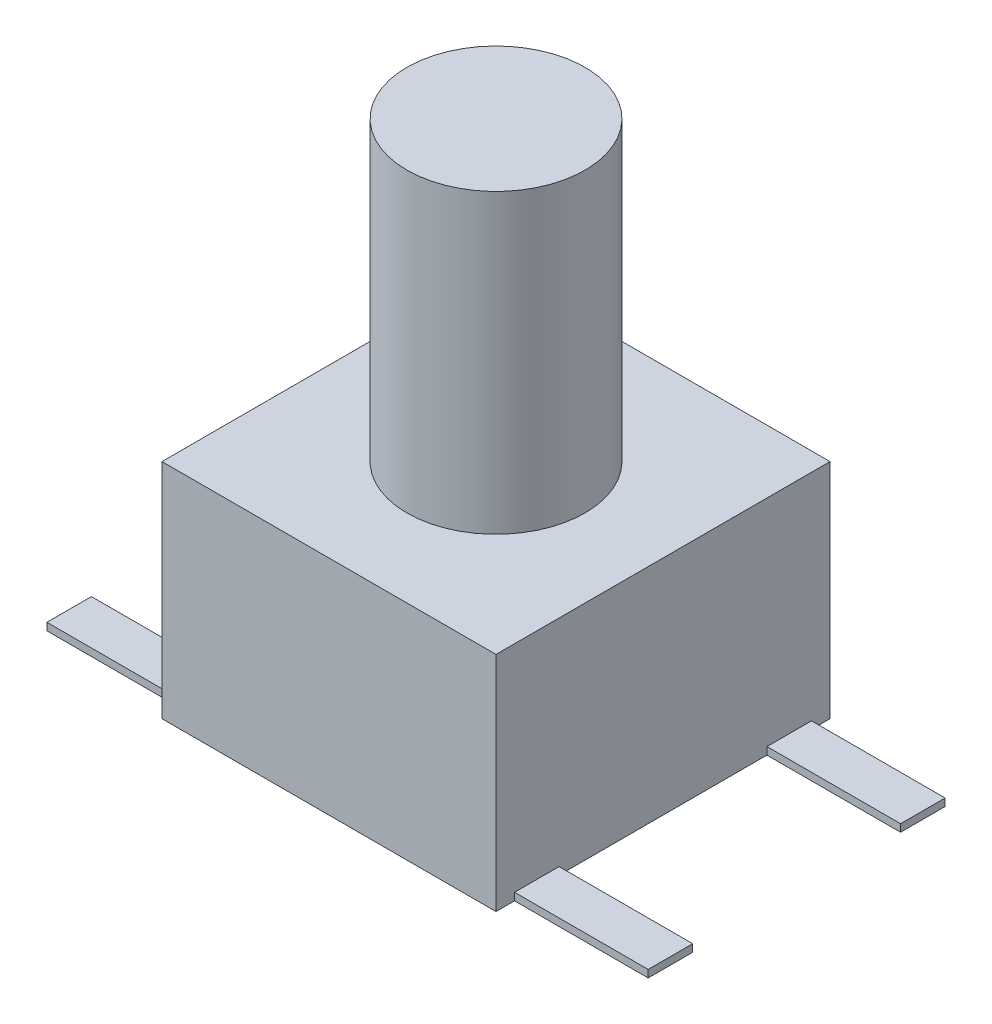
from build123d import *

# Parameters (mm, degrees)
SKETCH_1_W        = 4.5
SKETCH_1_H        = 4.5
EXTRUDE_1_DEPTH   = 3
SKETCH_2_R        = 1.2
EXTRUDE_2_DEPTH   = 7
SKETCH_3_W        = 1.8
SKETCH_3_H        = 0.6
EXTRUDE_3_DEPTH   = 0.1
EXTRUDE_3_2_DEPTH = 0.1
EXTRUDE_3_3_DEPTH = 0.1
EXTRUDE_3_4_DEPTH = 0.1


with BuildPart() as part:
    # Эскиз1 → Бобышка-Вытянуть1 (new body)
    with BuildSketch(Plane(origin=(0, 0, 0), x_dir=(1, 0, 0), z_dir=(0, 1, 0))):
        Rectangle(SKETCH_1_W, SKETCH_1_H)
    extrude(amount=EXTRUDE_1_DEPTH)

    # Эскиз2 → Бобышка-Вытянуть2 (add)
    with BuildSketch(Plane(origin=(0, 0, 0), x_dir=(1, 0, 0), z_dir=(0, 1, 0))):
        with Locations(Location((0, 0, 0), (0, 0, 270))):
            Circle(SKETCH_2_R)
    extrude(amount=EXTRUDE_2_DEPTH)


with BuildPart() as body_2:
    # Эскиз3 → Бобышка-Вытянуть3 (new body)
    with BuildSketch(Plane(origin=(0, 0, 0), x_dir=(1, 0, 0), z_dir=(0, 1, 0))):
        with Locations((-3.15, -1.7)):
            Rectangle(SKETCH_3_W, SKETCH_3_H)
    extrude(amount=EXTRUDE_3_DEPTH)


with BuildPart() as body_3:
    # Эскиз3 → Extrude 3 2 (new body)
    with BuildSketch(Plane(origin=(0, 0, 0), x_dir=(1, 0, 0), z_dir=(0, 1, 0))):
        with Locations((-3.15, 1.7)):
            Rectangle(SKETCH_3_W, SKETCH_3_H)
    extrude(amount=EXTRUDE_3_2_DEPTH)


with BuildPart() as body_4:
    # Эскиз3 → Extrude 3 3 (new body)
    with BuildSketch(Plane(origin=(0, 0, 0), x_dir=(1, 0, 0), z_dir=(0, 1, 0))):
        with Locations((3.15, 1.7)):
            Rectangle(SKETCH_3_W, SKETCH_3_H)
    extrude(amount=EXTRUDE_3_3_DEPTH)


with BuildPart() as body_5:
    # Эскиз3 → Extrude 3 4 (new body)
    with BuildSketch(Plane(origin=(0, 0, 0), x_dir=(1, 0, 0), z_dir=(0, 1, 0))):
        with Locations((3.15, -1.7)):
            Rectangle(SKETCH_3_W, SKETCH_3_H)
    extrude(amount=EXTRUDE_3_4_DEPTH)


solid = Compound([part.part, body_2.part, body_3.part, body_4.part, body_5.part])
